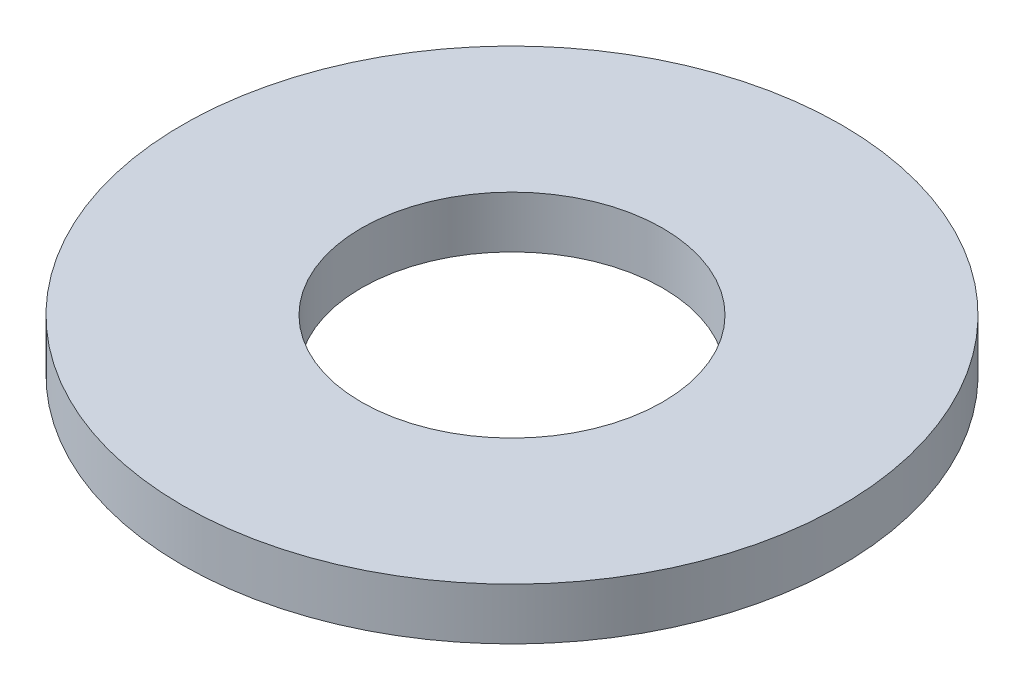
from build123d import *

# Parameters (mm, degrees)
SKETCH1_R           = 3.5
SKETCH1_R_2         = 1.6
BOSS_EXTRUDE1_DEPTH = 0.55


with BuildPart() as part:
    # Sketch1 → Boss-Extrude1 (new body)
    with BuildSketch(Plane(origin=(0, 0, 0), x_dir=(1, 0, 0), z_dir=(0, 1, 0))):
        with Locations(Location((0, 0, 0), (0, 0, 270))):
            Circle(SKETCH1_R)
        with Locations(Location((0, 0, 0), (0, 0, 270))):
            Circle(SKETCH1_R_2, mode=Mode.SUBTRACT)
    extrude(amount=BOSS_EXTRUDE1_DEPTH)


solid = part.part
